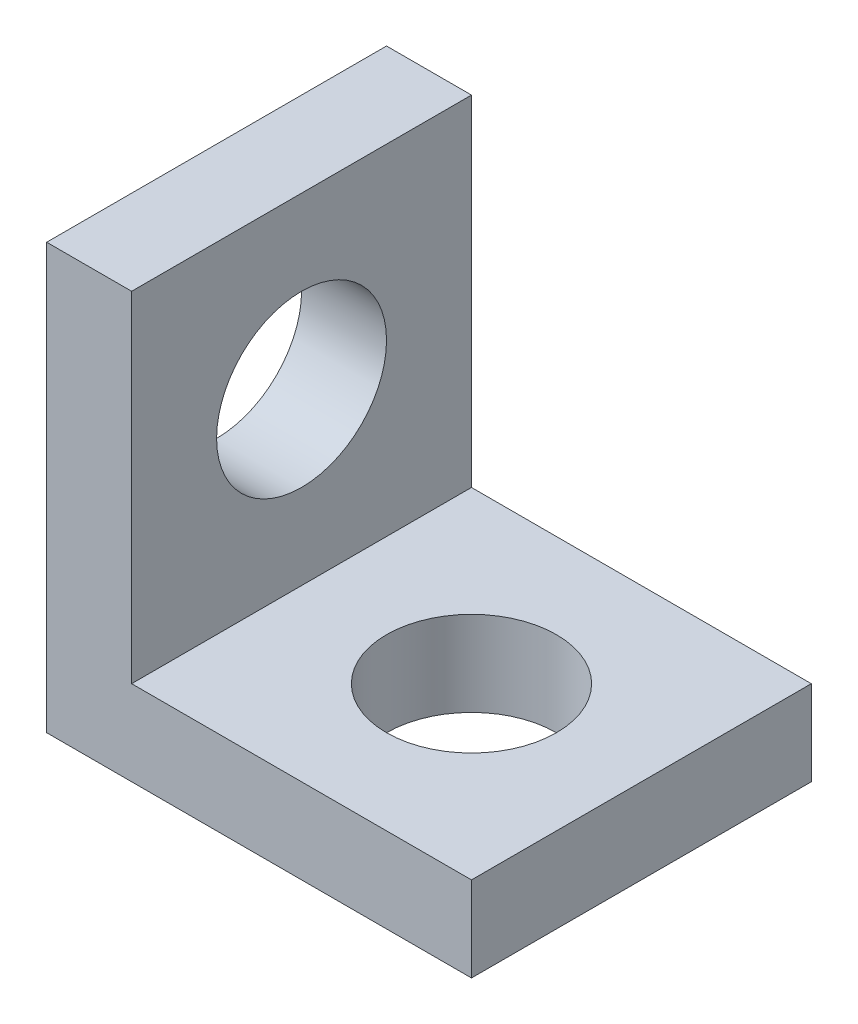
from build123d import *

# Parameters (mm, degrees)
BOSS_EXTRUDE1_DEPTH = 12.7
SKETCH2_R           = 3.175
CUT_EXTRUDE1_DEPTH  = 12.7
SKETCH3_R           = 3.175
CUT_EXTRUDE2_DEPTH  = 12.7


with BuildPart() as part:
    # Sketch1 → Boss-Extrude1 (new body)
    with BuildSketch(Plane.XY):
        Polygon((-30.762128425, 2.921), (-30.762128425, -12.954), (-14.887128425, -12.954), (-14.887128425, -9.779), (-27.587128425, -9.779), (-27.587128425, 2.921), align=None)
    extrude(amount=BOSS_EXTRUDE1_DEPTH)

    # Sketch2 → Cut-Extrude1 (cut)
    with BuildSketch(Plane(origin=(-27.587128425, 0, 0), x_dir=(0, 0, -1), z_dir=(1, 0, 0))):
        with Locations((-6.35, -3.429)):
            Circle(SKETCH2_R)
    extrude(amount=-CUT_EXTRUDE1_DEPTH, mode=Mode.SUBTRACT)

    # Sketch3 → Cut-Extrude2 (cut)
    with BuildSketch(Plane(origin=(0, -9.779, 0), x_dir=(1, 0, 0), z_dir=(0, 1, 0))):
        with Locations(Location((-21.237128425, -6.35, 0), (0, 0, 180))):
            Circle(SKETCH3_R)
    extrude(amount=-CUT_EXTRUDE2_DEPTH, mode=Mode.SUBTRACT)


solid = part.part
